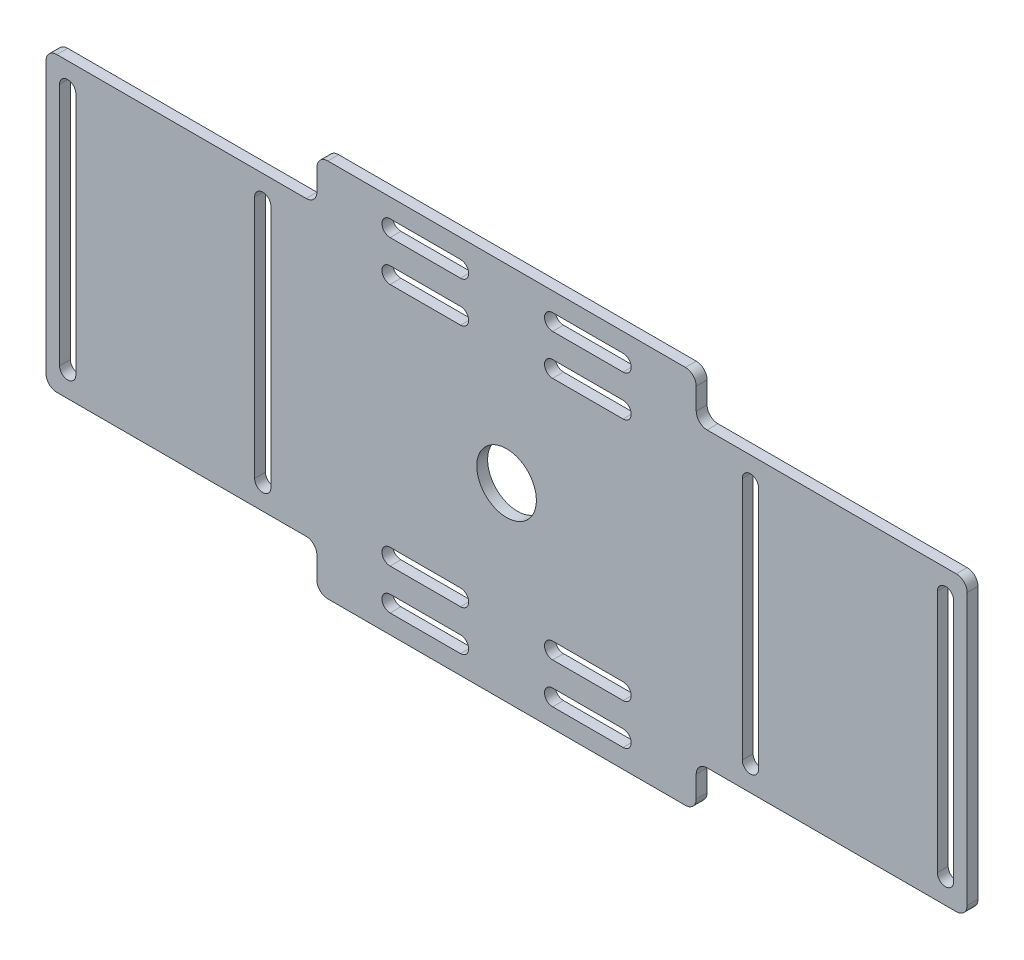
from build123d import *

# Parameters (mm, degrees)
SKETCH_1_W          = 170
SKETCH_1_H          = 70
EXTRUDE_1_DEPTH     = 2
SKETCH_2_R          = 5.5
CUT_EXTRUDE_1_DEPTH = 92.945636112
CUT_EXTRUDE_2_DEPTH = 92.945636112


with BuildPart() as part:
    # 草圖1 → 填料-伸長1 (new body)
    with BuildSketch(Plane.XY):
        Rectangle(SKETCH_1_W, SKETCH_1_H)
    extrude(amount=EXTRUDE_1_DEPTH)

    # 草圖2 → 除料-伸長1 (cut, through all)
    with BuildSketch(Plane.XY.offset(2)):
        Circle(SKETCH_2_R)
        with BuildLine():
            Line((43.5, -22.5), (43.5, 22.5))
            ThreePointArc((43.5, 22.5), (45, 24), (46.5, 22.5))
            Line((46.5, 22.5), (46.5, -22.5))
            ThreePointArc((46.5, -22.5), (45, -24), (43.5, -22.5))
        make_face()
        with BuildLine():
            Line((-46.5, -22.5), (-46.5, 22.5))
            ThreePointArc((-46.5, 22.5), (-45, 24), (-43.5, 22.5))
            Line((-43.5, 22.5), (-43.5, -22.5))
            ThreePointArc((-43.5, -22.5), (-45, -24), (-46.5, -22.5))
        make_face()
        with BuildLine():
            Line((21.5, 28.5), (8.5, 28.5))
            ThreePointArc((8.5, 28.5), (7, 30), (8.5, 31.5))
            Line((8.5, 31.5), (21.5, 31.5))
            ThreePointArc((21.5, 31.5), (23, 30), (21.5, 28.5))
        make_face()
        with BuildLine():
            Line((-82.5, -22.5), (-82.5, 22.5))
            ThreePointArc((-82.5, 22.5), (-81, 24), (-79.5, 22.5))
            Line((-79.5, 22.5), (-79.5, -22.5))
            ThreePointArc((-79.5, -22.5), (-81, -24), (-82.5, -22.5))
        make_face()
        with BuildLine():
            Line((79.5, -22.5), (79.5, 22.5))
            ThreePointArc((79.5, 22.5), (81, 24), (82.5, 22.5))
            Line((82.5, 22.5), (82.5, -22.5))
            ThreePointArc((82.5, -22.5), (81, -24), (79.5, -22.5))
        make_face()
        with BuildLine():
            Line((21.5, 21), (8.5, 21))
            ThreePointArc((8.5, 21), (7, 22.5), (8.5, 24))
            Line((8.5, 24), (21.5, 24))
            ThreePointArc((21.5, 24), (23, 22.5), (21.5, 21))
        make_face()
        with BuildLine():
            Line((-21.5, 28.5), (-8.5, 28.5))
            ThreePointArc((-8.5, 28.5), (-7, 30), (-8.5, 31.5))
            Line((-8.5, 31.5), (-21.5, 31.5))
            ThreePointArc((-21.5, 31.5), (-23, 30), (-21.5, 28.5))
        make_face()
        with BuildLine():
            Line((-21.5, 21), (-8.5, 21))
            ThreePointArc((-8.5, 21), (-7, 22.5), (-8.5, 24))
            Line((-8.5, 24), (-21.5, 24))
            ThreePointArc((-21.5, 24), (-23, 22.5), (-21.5, 21))
        make_face()
        with BuildLine():
            Line((21.5, -28.5), (8.5, -28.5))
            ThreePointArc((8.5, -28.5), (7, -30), (8.5, -31.5))
            Line((8.5, -31.5), (21.5, -31.5))
            ThreePointArc((21.5, -31.5), (23, -30), (21.5, -28.5))
        make_face()
        with BuildLine():
            Line((21.5, -21), (8.5, -21))
            ThreePointArc((8.5, -21), (7, -22.5), (8.5, -24))
            Line((8.5, -24), (21.5, -24))
            ThreePointArc((21.5, -24), (23, -22.5), (21.5, -21))
        make_face()
        with BuildLine():
            Line((-21.5, -28.5), (-8.5, -28.5))
            ThreePointArc((-8.5, -28.5), (-7, -30), (-8.5, -31.5))
            Line((-8.5, -31.5), (-21.5, -31.5))
            ThreePointArc((-21.5, -31.5), (-23, -30), (-21.5, -28.5))
        make_face()
        with BuildLine():
            Line((-21.5, -21), (-8.5, -21))
            ThreePointArc((-8.5, -21), (-7, -22.5), (-8.5, -24))
            Line((-8.5, -24), (-21.5, -24))
            ThreePointArc((-21.5, -24), (-23, -22.5), (-21.5, -21))
        make_face()
    extrude(amount=-CUT_EXTRUDE_1_DEPTH, mode=Mode.SUBTRACT)

    # 草圖4 → 除料-伸長2 (cut, through all)
    with BuildSketch(Plane.XY.offset(2)):
        with BuildLine():
            Line((85, 35), (33, 35))
            ThreePointArc((33, 35), (34.414213562, 34.414213562), (35, 33))
            Line((35, 33), (35, 29))
            ThreePointArc((35, 29), (35.585786438, 27.585786438), (37, 27))
            Line((37, 27), (83, 27))
            ThreePointArc((83, 27), (84.414213562, 26.414213562), (85, 25))
            Line((85, 25), (85, 35))
        make_face()
        with BuildLine():
            Line((35, -33), (35, -29))
            ThreePointArc((35, -29), (35.585786438, -27.585786438), (37, -27))
            Line((37, -27), (83, -27))
            ThreePointArc((83, -27), (84.414213562, -26.414213562), (85, -25))
            Line((85, -25), (85, -35))
            Line((85, -35), (33, -35))
            ThreePointArc((33, -35), (34.414213562, -34.414213562), (35, -33))
        make_face()
        with BuildLine():
            Line((-85, -35), (-33, -35))
            ThreePointArc((-33, -35), (-34.414213562, -34.414213562), (-35, -33))
            Line((-35, -33), (-35, -29))
            ThreePointArc((-35, -29), (-35.585786438, -27.585786438), (-37, -27))
            Line((-37, -27), (-83, -27))
            ThreePointArc((-83, -27), (-84.414213562, -26.414213562), (-85, -25))
            Line((-85, -25), (-85, -35))
        make_face()
        with BuildLine():
            Line((-35, 33), (-35, 29))
            ThreePointArc((-35, 29), (-35.585786438, 27.585786438), (-37, 27))
            Line((-37, 27), (-83, 27))
            ThreePointArc((-83, 27), (-84.414213562, 26.414213562), (-85, 25))
            Line((-85, 25), (-85, 35))
            Line((-85, 35), (-33, 35))
            ThreePointArc((-33, 35), (-34.414213562, 34.414213562), (-35, 33))
        make_face()
    extrude(amount=-CUT_EXTRUDE_2_DEPTH, mode=Mode.SUBTRACT)


solid = part.part
